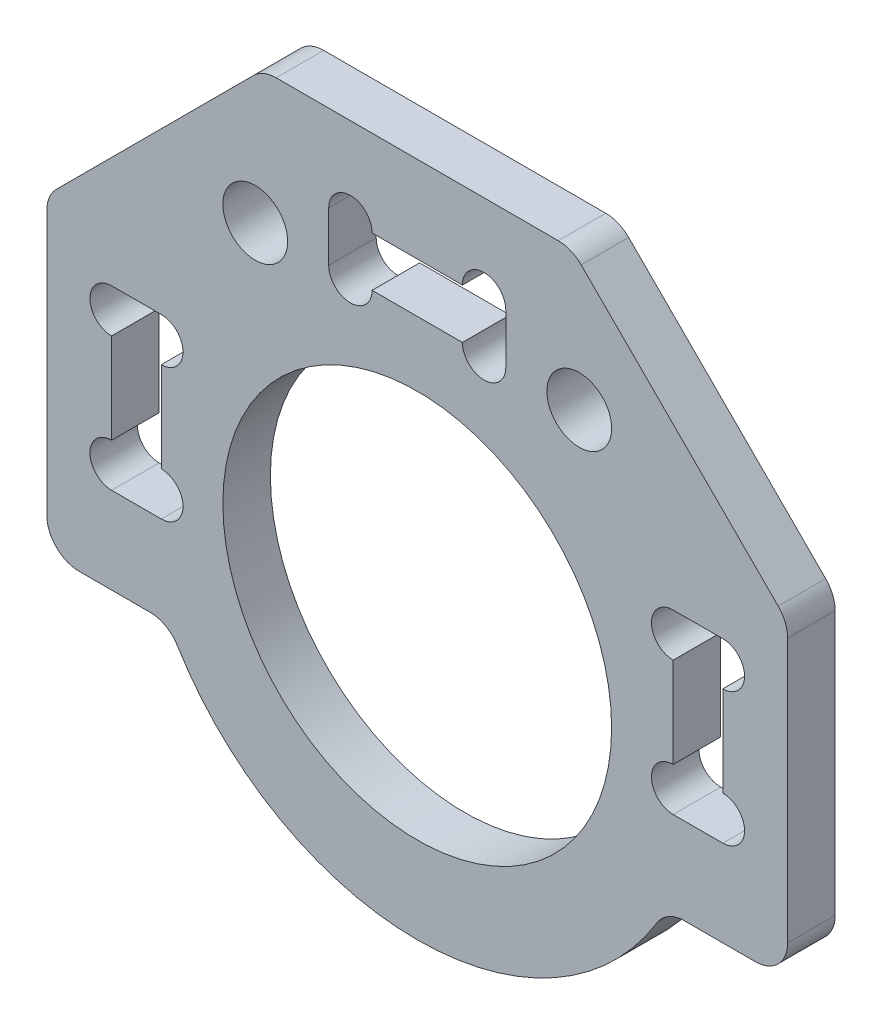
from build123d import *

# Parameters (mm, degrees)
SKETCH_1_R      = 9
SKETCH_1_R_2    = 1.5
EXTRUDE_1_DEPTH = 2.2
CHAMFER_1_SIZE  = 10
FILLET_1_R      = 1.5


with BuildPart() as part:
    # 草图1 → 凸台-拉伸1 (new body)
    with BuildSketch(Plane.XY):
        with BuildLine():
            Line((-17.15, -19.2), (-11.506411256, -19.2))
            ThreePointArc((-11.506411256, -19.2), (0, -26.15), (11.506411256, -19.2))
            Line((11.506411256, -19.2), (17.15, -19.2))
            Line((17.15, -19.2), (17.15, 5.15))
            Line((17.15, 5.15), (-17.15, 5.15))
            Line((-17.15, 5.15), (-17.15, -19.2))
        make_face()
        with BuildLine():
            ThreePointArc((-10.845, -14.195), (-11.139357685, -14.905642315), (-11.85, -15.2))
            Line((-11.85, -15.2), (-14.15, -15.2))
            ThreePointArc((-14.15, -15.2), (-15.155, -14.195), (-14.15, -13.19))
            Line((-14.15, -13.19), (-14.15, -9.01))
            ThreePointArc((-14.15, -9.01), (-15.155, -8.005), (-14.15, -7))
            Line((-14.15, -7), (-11.85, -7))
            ThreePointArc((-11.85, -7), (-11.139357685, -7.294357685), (-10.845, -8.005))
            ThreePointArc((-10.845, -8.005), (-11.139357685, -8.715642315), (-11.85, -9.01))
            Line((-11.85, -9.01), (-11.85, -13.19))
            ThreePointArc((-11.85, -13.19), (-11.139357685, -13.484357685), (-10.845, -14.195))
        make_face(mode=Mode.SUBTRACT)
        with Locations((0, -13.15)):
            Circle(SKETCH_1_R, mode=Mode.SUBTRACT)
        with BuildLine():
            ThreePointArc((11.85, -9.01), (10.845, -8.005), (11.85, -7))
            Line((11.85, -7), (14.15, -7))
            ThreePointArc((14.15, -7), (14.860642315, -7.294357685), (15.155, -8.005))
            ThreePointArc((15.155, -8.005), (14.860642315, -8.715642315), (14.15, -9.01))
            Line((14.15, -9.01), (14.15, -13.19))
            ThreePointArc((14.15, -13.19), (14.860642315, -13.484357685), (15.155, -14.195))
            ThreePointArc((15.155, -14.195), (14.860642315, -14.905642315), (14.15, -15.2))
            Line((14.15, -15.2), (11.85, -15.2))
            ThreePointArc((11.85, -15.2), (10.845, -14.195), (11.85, -13.19))
            Line((11.85, -13.19), (11.85, -9.01))
        make_face(mode=Mode.SUBTRACT)
        with Locations((-7.5, -1.15)):
            Circle(SKETCH_1_R_2, mode=Mode.SUBTRACT)
        with BuildLine():
            Line((2.09, -1.15), (-2.09, -1.15))
            ThreePointArc((-2.09, -1.15), (-3.095, -2.155), (-4.1, -1.15))
            Line((-4.1, -1.15), (-4.1, 1.15))
            ThreePointArc((-4.1, 1.15), (-3.095, 2.155), (-2.09, 1.15))
            Line((-2.09, 1.15), (2.09, 1.15))
            ThreePointArc((2.09, 1.15), (3.095, 2.155), (4.1, 1.15))
            Line((4.1, 1.15), (4.1, -1.15))
            ThreePointArc((4.1, -1.15), (3.095, -2.155), (2.09, -1.15))
        make_face(mode=Mode.SUBTRACT)
        with Locations((7.5, -1.15)):
            Circle(SKETCH_1_R_2, mode=Mode.SUBTRACT)
    extrude(amount=EXTRUDE_1_DEPTH)

    # 倒角1
    chamfer_1_edges = [part.edges().sort_by_distance(p)[0] for p in [
        (-17.15, 5.15, 1.1),
        (17.15, 5.15, 1.1),
    ]]
    chamfer(chamfer_1_edges, length=CHAMFER_1_SIZE)

    # 圆角1
    fillet_1_edges = [part.edges().sort_by_distance(p)[0] for p in [
        (-17.15, -4.85, 1.1),
        (-17.15, -19.2, 1.1),
        (17.15, -19.2, 1.1),
        (11.506411256, -19.2, 1.1),
        (-11.506411256, -19.2, 1.1),
        (-7.15, 5.15, 1.1),
        (7.15, 5.15, 1.1),
        (17.15, -4.85, 1.1),
    ]]
    fillet(fillet_1_edges, radius=FILLET_1_R)


solid = part.part
